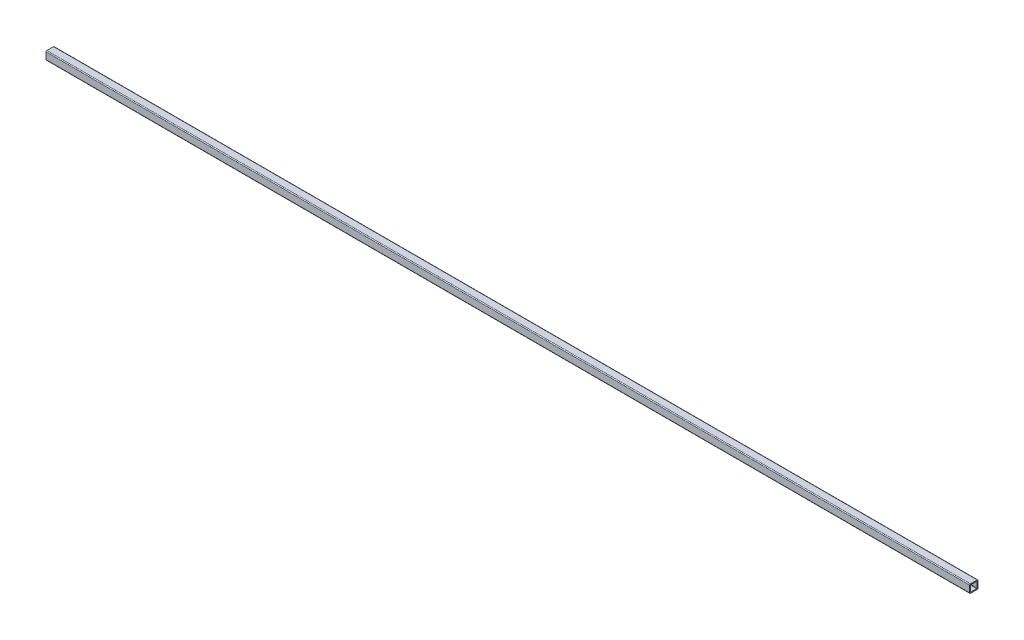
from build123d import *

# Parameters (mm, degrees)
SKETCH3_W           = 25.4
SKETCH3_H           = 25.4
SKETCH3_W_2         = 19.304
SKETCH3_H_2         = 19.304
BOSS_EXTRUDE1_DEPTH = 2830
FILLET1_R           = 2.5
FILLET2_R           = 1


with BuildPart() as part:
    # Sketch3 → Boss-Extrude1 (new body)
    with BuildSketch(Plane(origin=(0, 0, 0), x_dir=(0, 0, -1), z_dir=(1, 0, 0))):
        Rectangle(SKETCH3_W, SKETCH3_H)
        Rectangle(SKETCH3_W_2, SKETCH3_H_2, mode=Mode.SUBTRACT)
    extrude(amount=-BOSS_EXTRUDE1_DEPTH)

    # Fillet1
    fillet1_edges = [part.edges().sort_by_distance(p)[0] for p in [
        (-1415, -12.7, -12.7),
        (-1415, -12.7, 12.7),
        (-1415, 12.7, 12.7),
        (-1415, 12.7, -12.7),
    ]]
    fillet(fillet1_edges, radius=FILLET1_R)

    # Fillet2
    fillet2_edges = [part.edges().sort_by_distance(p)[0] for p in [
        (-1415, 9.652, -9.652),
        (-1415, -9.652, -9.652),
        (-1415, -9.652, 9.652),
        (-1415, 9.652, 9.652),
    ]]
    fillet(fillet2_edges, radius=FILLET2_R)


solid = part.part
